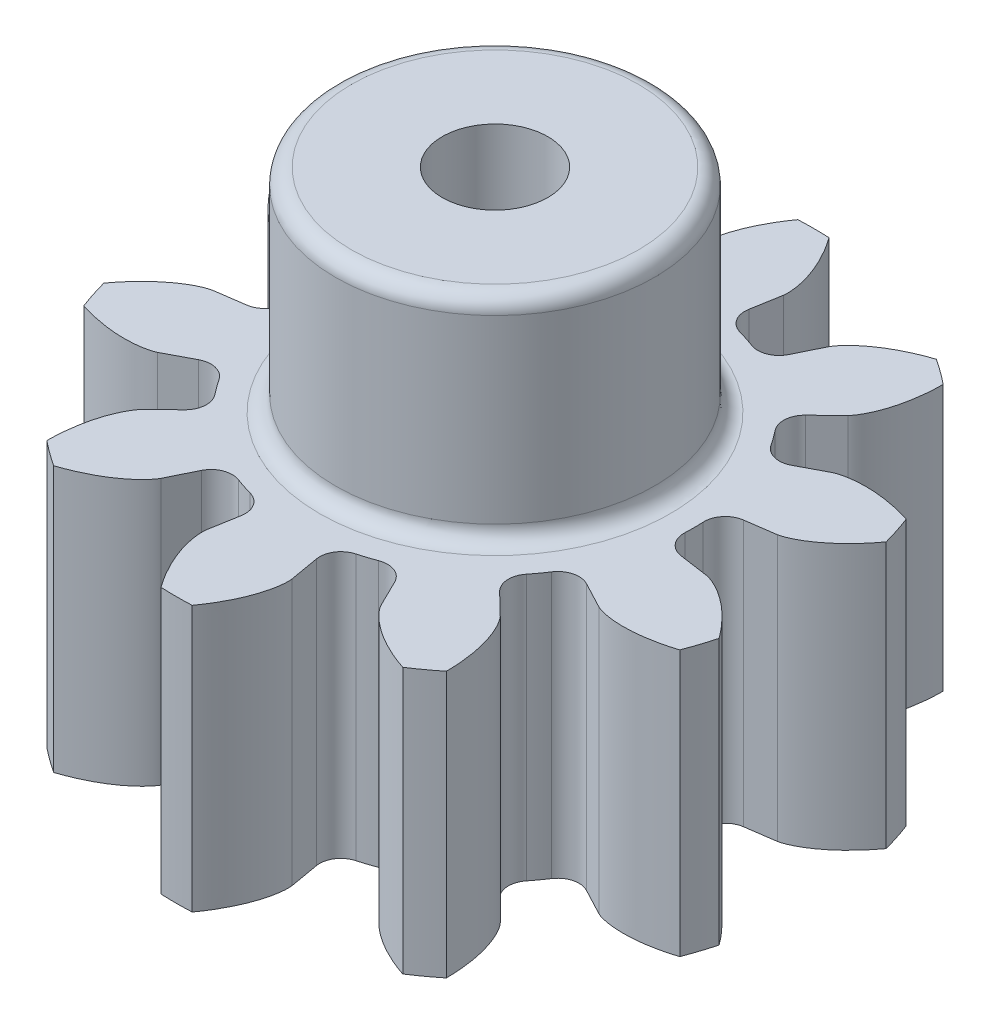
from build123d import *

# Parameters (mm, degrees)
SKETCH2_R                = 15.24
BOSS_EXTRUDE1_DEPTH      = 12.7
CUT_EXTRUDE1_DEPTH       = 26.016098817
FILLET1_R                = 1.016
CIRPATTERN1_COUNT        = 10
FILLET1_OF_CIRPATTERN1_R = 1.016
SKETCH4_R                = 7.62
SKETCH4_R_2              = 2.525
BOSS_EXTRUDE2_DEPTH      = 10.16
SKETCH5_R                = 2.525
CUT_EXTRUDE2_DEPTH       = 25.695174454
FILLET2_R                = 0.762


with BuildPart() as part:
    # Sketch2 → Boss-Extrude1 (new body)
    with BuildSketch(Plane(origin=(0, 0, 0), x_dir=(1, 0, 0), z_dir=(0, 1, 0))):
        with Locations(Location((0, 0, 0), (0, 0, 270))):
            Circle(SKETCH2_R)
    extrude(amount=BOSS_EXTRUDE1_DEPTH)

    # Sketch3 → Cut-Extrude1 (cut, through all)
    with BuildSketch(Plane(origin=(0, 0, 0), x_dir=(-1, 0, 0), z_dir=(0, -1, 0))):
        with BuildLine():
            Line((9.428893824, -1.349661534), (11.813682598, -1.691022645))
            add(Edge.make_bspline(
                [(11.813682598, -1.691022645), (11.814646516, -1.691177191), (11.815609877, -1.691334864), (11.816572702, -1.691495523), (11.817535009, -1.691659038)],
                knots=[0, 0, 0, 0, 0, 0.000943043, 0.000943043, 0.000943043, 0.000943043, 0.000943043], degree=4))
            ThreePointArc((11.817535009, -1.691659038), (11.907845669, -0.84797142), (11.938, 0))
            ThreePointArc((11.938, 0), (11.907845669, 0.84797142), (11.817535009, 1.691659038))
            add(Edge.make_bspline(
                [(11.813682598, 1.691022645), (11.814646516, 1.691177191), (11.815609877, 1.691334864), (11.816572702, 1.691495523), (11.817535009, 1.691659038)],
                knots=[0, 0, 0, 0, 0, 0.000943043, 0.000943043, 0.000943043, 0.000943043, 0.000943043], degree=4))
            Line((11.813682598, 1.691022645), (9.428893824, 1.349661534))
            ThreePointArc((9.428893824, 1.349661534), (9.500943076, 0.676539477), (9.525, 0))
            ThreePointArc((9.525, 0), (9.500943076, -0.676539477), (9.428893824, -1.349661534))
        make_face()
        with BuildLine():
            ThreePointArc((11.938, 0), (11.907845669, -0.84797142), (11.817535009, -1.691659038))
            add(Edge.make_bspline(
                [(11.817535009, -1.691659038), (11.822059291, -1.6924278), (11.836452372, -1.69508097), (11.864346277, -1.701241406), (11.910150555, -1.712933326), (11.969184939, -1.730464153), (12.04479756, -1.755773638), (12.132910439, -1.7889748), (12.228645625, -1.82897949), (12.331522072, -1.876262838), (12.423087978, -1.921823271), (12.488480876, -1.956422296), (12.528506963, -1.97833095), (12.54364169, -1.986719191)],
                knots=[0.000943043, 0.000943043, 0.000943043, 0.000943043, 0.000943043, 0.005376749, 0.015083688, 0.02853182, 0.046610139, 0.064854849, 0.092110525, 0.119476176, 0.146842496, 0.174208854, 0.190928826, 0.190928826, 0.190928826, 0.190928826, 0.190928826], degree=4))
            ThreePointArc((12.54364169, -1.986719191), (12.660850079, -0.996431265), (12.7, 0))
            ThreePointArc((12.7, 0), (12.660850079, 0.996431265), (12.54364169, 1.986719191))
            add(Edge.make_bspline(
                [(11.817535009, 1.691659038), (11.822059291, 1.6924278), (11.836452372, 1.69508097), (11.864346277, 1.701241406), (11.910150555, 1.712933326), (11.969184939, 1.730464153), (12.04479756, 1.755773638), (12.132910439, 1.7889748), (12.228645625, 1.82897949), (12.331522072, 1.876262838), (12.423087978, 1.921823271), (12.488480876, 1.956422296), (12.528506963, 1.97833095), (12.54364169, 1.986719191)],
                knots=[0.000943043, 0.000943043, 0.000943043, 0.000943043, 0.000943043, 0.005376749, 0.015083688, 0.02853182, 0.046610139, 0.064854849, 0.092110525, 0.119476176, 0.146842496, 0.174208854, 0.190928826, 0.190928826, 0.190928826, 0.190928826, 0.190928826], degree=4))
            ThreePointArc((11.817535009, 1.691659038), (11.907845669, 0.84797142), (11.938, 0))
        make_face()
        with BuildLine():
            ThreePointArc((12.7, 0), (12.660850079, -0.996431265), (12.54364169, -1.986719191))
            add(Edge.make_bspline(
                [(12.54364169, -1.986719191), (12.553278445, -1.992060247), (12.587620956, -2.011245326), (12.646289288, -2.044939026), (12.749370299, -2.106907896), (12.888801103, -2.196315459), (13.048717462, -2.307123688), (13.226338861, -2.440160727), (13.403109396, -2.583451627), (13.573472712, -2.730730451), (13.741256687, -2.886575073), (13.90049908, -3.042342342), (14.06117781, -3.211114463), (14.207107268, -3.370471575), (14.365124352, -3.556498071), (14.491066541, -3.708832868), (14.616438915, -3.872275149), (14.676753563, -3.95271226), (14.707278225, -3.994191683)],
                knots=[0.190928826, 0.190928826, 0.190928826, 0.190928826, 0.190928826, 0.201574956, 0.228941013, 0.256307345, 0.307035032, 0.361767352, 0.41649966, 0.471231936, 0.525964282, 0.580696615, 0.635428982, 0.690161387, 0.744893688, 0.799626082, 0.854358408, 0.909090915, 0.909090915, 0.909090915, 0.909090915, 0.909090915], degree=4))
            ThreePointArc((14.707278225, -3.994191683), (15.106232491, -2.014780366), (15.24, 0))
            ThreePointArc((15.24, 0), (15.106232491, 2.014780366), (14.707278225, 3.994191683))
            add(Edge.make_bspline(
                [(12.54364169, 1.986719191), (12.553278445, 1.992060247), (12.587620956, 2.011245326), (12.646289288, 2.044939026), (12.749370299, 2.106907896), (12.888801103, 2.196315459), (13.048717462, 2.307123688), (13.226338861, 2.440160727), (13.403109396, 2.583451627), (13.573472712, 2.730730451), (13.741256687, 2.886575073), (13.90049908, 3.042342342), (14.06117781, 3.211114463), (14.207107268, 3.370471575), (14.365124352, 3.556498071), (14.491066541, 3.708832868), (14.616438915, 3.872275149), (14.676753563, 3.95271226), (14.707278225, 3.994191683)],
                knots=[0.190928826, 0.190928826, 0.190928826, 0.190928826, 0.190928826, 0.201574956, 0.228941013, 0.256307345, 0.307035032, 0.361767352, 0.41649966, 0.471231936, 0.525964282, 0.580696615, 0.635428982, 0.690161387, 0.744893688, 0.799626082, 0.854358408, 0.909090915, 0.909090915, 0.909090915, 0.909090915, 0.909090915], degree=4))
            ThreePointArc((12.54364169, 1.986719191), (12.660850079, 0.996431265), (12.7, 0))
        make_face()
    cut_extrude1 = extrude(amount=-CUT_EXTRUDE1_DEPTH, mode=Mode.SUBTRACT)

    # Fillet1
    fillet1_edges = [part.edges().sort_by_distance(p)[0] for p in [
        (-9.428893824, 6.35, 1.349661534),
        (-9.428893824, 6.35, -1.349661534),
    ]]
    fillet(fillet1_edges, radius=FILLET1_R)

    # CirPattern1: Cut-Extrude1 ×10 about axis
    cirpattern1_axis = Axis((0, 0, 0), (0, 1, 0))
    for i in range(1, CIRPATTERN1_COUNT):
        add(cut_extrude1.rotate(cirpattern1_axis, i * 360 / CIRPATTERN1_COUNT), mode=Mode.SUBTRACT)

    # Fillet1 of CirPattern1
    fillet1_of_cirpattern1_edges = [part.edges().sort_by_distance(p)[0] for p in [
        (-6.834824196, 6.35, 6.634063853),
        (-8.421446487, 6.35, 4.450265617),
        (-1.630084033, 6.35, 9.384479263),
        (-4.197292826, 6.35, 8.550342562),
        (4.197292826, 6.35, 8.550342562),
        (1.630084033, 6.35, 9.384479263),
        (8.421446487, 6.35, 4.450265617),
        (6.834824196, 6.35, 6.634063853),
        (9.428893824, 6.35, -1.349661534),
        (9.428893824, 6.35, 1.349661534),
        (6.834824196, 6.35, -6.634063853),
        (8.421446487, 6.35, -4.450265617),
        (1.630084033, 6.35, -9.384479263),
        (4.197292826, 6.35, -8.550342562),
        (-4.197292826, 6.35, -8.550342562),
        (-1.630084033, 6.35, -9.384479263),
        (-8.421446487, 6.35, -4.450265617),
        (-6.834824196, 6.35, -6.634063853),
    ]]
    fillet(fillet1_of_cirpattern1_edges, radius=FILLET1_OF_CIRPATTERN1_R)

    # Sketch4 → Boss-Extrude2 (add)
    with BuildSketch(Plane(origin=(0, 12.7, 0), x_dir=(1, 0, 0), z_dir=(0, 1, 0))):
        with Locations(Location((0, 0, 0), (0, 0, 270))):
            Circle(SKETCH4_R)
        with Locations(Location((0, 0, 0), (0, 0, 270))):
            Circle(SKETCH4_R_2, mode=Mode.SUBTRACT)
    extrude(amount=BOSS_EXTRUDE2_DEPTH)

    # Sketch5 → Cut-Extrude2 (cut, through all)
    with BuildSketch(Plane(origin=(0, 12.7, 0), x_dir=(1, 0, 0), z_dir=(0, 1, 0))):
        with Locations(Location((0, 0, 0), (0, 0, 270))):
            Circle(SKETCH5_R)
    extrude(amount=-CUT_EXTRUDE2_DEPTH, mode=Mode.SUBTRACT)

    # Fillet2
    fillet2_edges = [part.edges().sort_by_distance(p)[0] for p in [
        (0, 22.86, -7.62),
        (0, 12.7, -7.62),
    ]]
    fillet(fillet2_edges, radius=FILLET2_R)


solid = part.part
